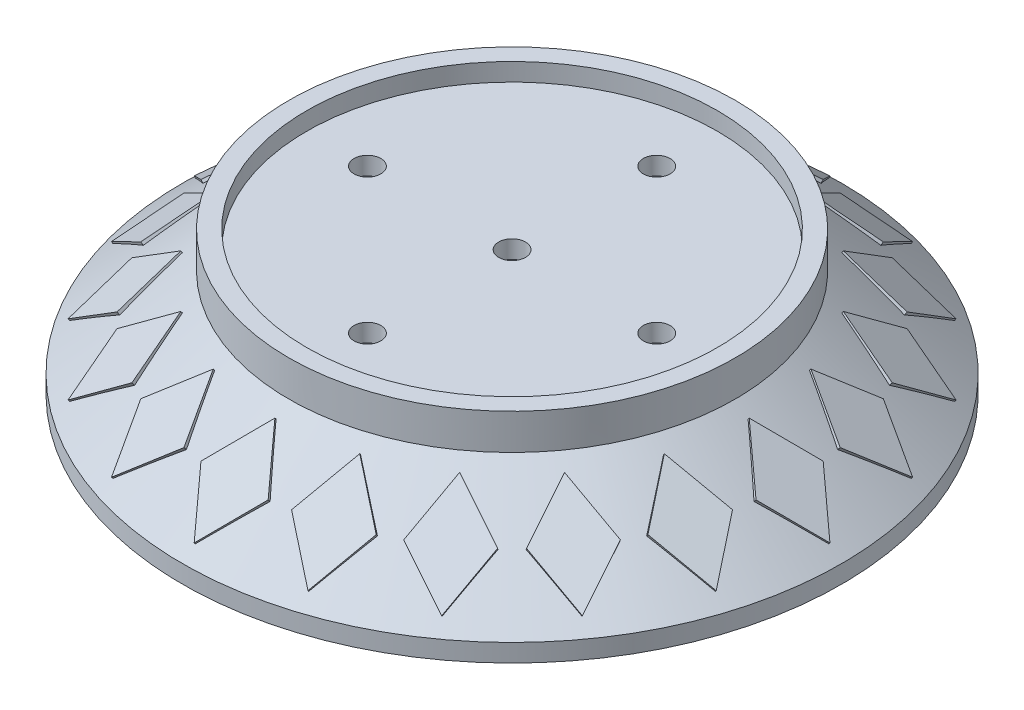
from build123d import *

# Parameters (mm, degrees)
SKETCH1_R           = 31.75
SKETCH1_R_2         = 1.905
BOSS_EXTRUDE1_DEPTH = 2.54
SKETCH2_R           = 31.75
SKETCH2_R_2         = 29.21
BOSS_EXTRUDE2_DEPTH = 2.54
SKETCH3_R           = 31.75
BOSS_EXTRUDE3_DEPTH = 12.7
BOSS_EXTRUDE3_DRAFT = -50
SKETCH4_R           = 46.885270626
BOSS_EXTRUDE4_DEPTH = 2.54
BOSS_EXTRUDE5_START = -1.27
BOSS_EXTRUDE5_DEPTH = 1.524
CIRPATTERN1_COUNT   = 20


with BuildPart() as part:
    # Sketch1 → Boss-Extrude1 (new body)
    with BuildSketch(Plane(origin=(0, 0, 0), x_dir=(1, 0, 0), z_dir=(0, 1, 0))):
        with Locations(Location((0, 0, 0), (0, 0, 270))):
            Circle(SKETCH1_R)
        with Locations(Location((0, 20.574, 0), (0, 0, 270))):
            Circle(SKETCH1_R_2, mode=Mode.SUBTRACT)
        with Locations(Location((20.574, 0, 0), (0, 0, 270))):
            Circle(SKETCH1_R_2, mode=Mode.SUBTRACT)
        with Locations(Location((0, -20.574, 0), (0, 0, 270))):
            Circle(SKETCH1_R_2, mode=Mode.SUBTRACT)
        with Locations(Location((-20.574, 0, 0), (0, 0, 270))):
            Circle(SKETCH1_R_2, mode=Mode.SUBTRACT)
        with Locations(Location((0, 0, 0), (0, 0, 270))):
            Circle(SKETCH1_R_2, mode=Mode.SUBTRACT)
    extrude(amount=BOSS_EXTRUDE1_DEPTH)

    # Sketch2 → Boss-Extrude2 (add)
    with BuildSketch(Plane(origin=(0, 2.54, 0), x_dir=(1, 0, 0), z_dir=(0, 1, 0))):
        with Locations(Location((0, 0, 0), (0, 0, 270))):
            Circle(SKETCH2_R)
        with Locations(Location((0, 0, 0), (0, 0, 270))):
            Circle(SKETCH2_R_2, mode=Mode.SUBTRACT)
    extrude(amount=BOSS_EXTRUDE2_DEPTH)


with BuildPart() as boss_extrude3_tool:
    # Sketch3 → Boss-Extrude3 (with draft: the straight prism first)
    with BuildSketch(Plane.XZ):
        with Locations(Location((0, 0, 0), (0, 0, 270))):
            Circle(SKETCH3_R)
    extrude(amount=BOSS_EXTRUDE3_DEPTH)
    # Boss-Extrude3: the draft: its side faces are tilted about the plane it starts from
    boss_extrude3_sides = [boss_extrude3_tool.faces().sort_by_distance(p)[0] for p in [
        (0, -6.35, 31.75),
    ]]
    draft(boss_extrude3_sides, Plane.XZ, BOSS_EXTRUDE3_DRAFT)


with BuildPart() as part_1:
    add(part.part)

    # Boss-Extrude3: add boss_extrude3_tool
    add(boss_extrude3_tool.part)

    # Sketch4 → Boss-Extrude4 (add)
    with BuildSketch(Plane.XZ.offset(12.7)):
        with Locations(Location((0, 0, 0), (0, 0, 270))):
            Circle(SKETCH4_R)
    extrude(amount=BOSS_EXTRUDE4_DEPTH)

    # Sketch6 → Boss-Extrude5 (add)
    with BuildSketch(Plane(origin=(-39.317635313, -6.35, 0), x_dir=(0.7660444431189796, 0.6427876096865376, 0), z_dir=(-0.6427876096865376, 0.7660444431189797, 0)).offset(BOSS_EXTRUDE5_START)):
        Polygon((-7.497749953, 0), (0, -4.776593518), (7.497749953, 0), (0, 4.776593518), align=None)
    boss_extrude5 = extrude(amount=BOSS_EXTRUDE5_DEPTH)

    # CirPattern1: Boss-Extrude5 ×20 about axis
    cirpattern1_axis = Axis((0, 0, 0), (0, 1, 0))
    for i in range(1, CIRPATTERN1_COUNT):
        add(boss_extrude5.rotate(cirpattern1_axis, i * 360 / CIRPATTERN1_COUNT))


solid = part_1.part
